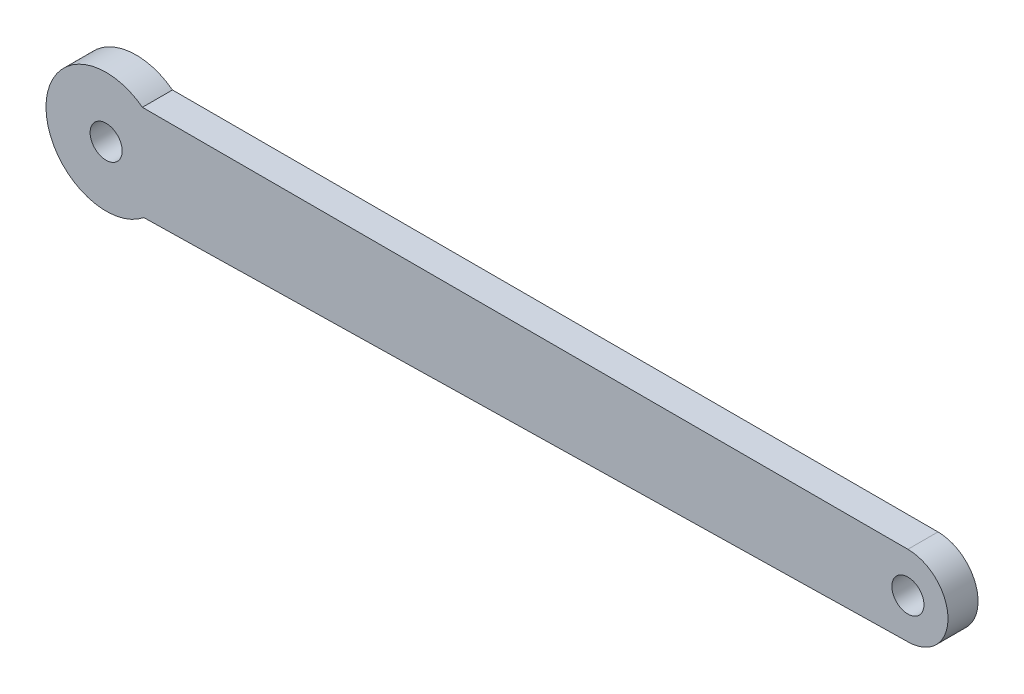
from build123d import *

# Parameters (mm, degrees)
EXTRUDE_1_DEPTH         = 3
SKETCH_2_R              = 1.35
CUT_EXTRUDE_1_DEPTH     = 2.444444444
SKETCH_3_R              = 1.35
CUT_EXTRUDE_2_DEPTH     = 0.555555556
HOLE_WIZARD_2_7_2_7_1_D = 2.7
SKETCH_6_R              = 1.6
CUT_EXTRUDE_3_DEPTH     = 64.035907885


with BuildPart() as part:
    # 草图1 → 凸台-拉伸1 (new body)
    with BuildSketch(Plane.XY.offset(3)):
        with BuildLine():
            Line((23.778016459, 8.467622986), (-52.596358319, 8.467622986))
            ThreePointArc((-52.596358319, 8.467622986), (-62.214907854, 3.590303351), (-52.451603626, -0.990377005))
            Line((-52.451603626, -0.990377005), (23.856567017, 0.468594516))
            ThreePointArc((23.856567017, 0.468594516), (27.777721585, 4.50700022), (23.778016459, 8.467622986))
        make_face()
    extrude(amount=-EXTRUDE_1_DEPTH)

    # 草图2 → 切除-拉伸1 (cut)
    with BuildSketch(Plane.XY.offset(3)):
        with Locations(Location((23.77801746, 4.467622995, 0), (0, 0, 180))):
            Circle(SKETCH_2_R)
    extrude(amount=-CUT_EXTRUDE_1_DEPTH, mode=Mode.SUBTRACT)

    # 草图3 → 切除-拉伸2 (cut)
    with BuildSketch(Plane(origin=(0, 0, 0), x_dir=(-1, 0, 0), z_dir=(0, 0, -1))):
        with Locations(Location((-23.778017455, 4.467823177, 0), (0, 0, 359.991504025))):
            Circle(SKETCH_3_R)
    extrude(amount=-CUT_EXTRUDE_2_DEPTH, mode=Mode.SUBTRACT)

    # Ø2.7 (2.7) 直径孔1 (through all)
    with Locations(Plane.XY.offset(3)):
        with Locations((-56.215609969, 3.682122995)):
            Hole(HOLE_WIZARD_2_7_2_7_1_D / 2)

    # 草图6 → 切除-拉伸3 (cut, through all)
    with BuildSketch(Plane.XY.offset(3)):
        with Locations((-56.215609969, 3.682122995)):
            Circle(SKETCH_6_R)
        with Locations((23.778017455, 4.467823177)):
            Circle(SKETCH_6_R)
    extrude(amount=-CUT_EXTRUDE_3_DEPTH, mode=Mode.SUBTRACT)


solid = part.part
